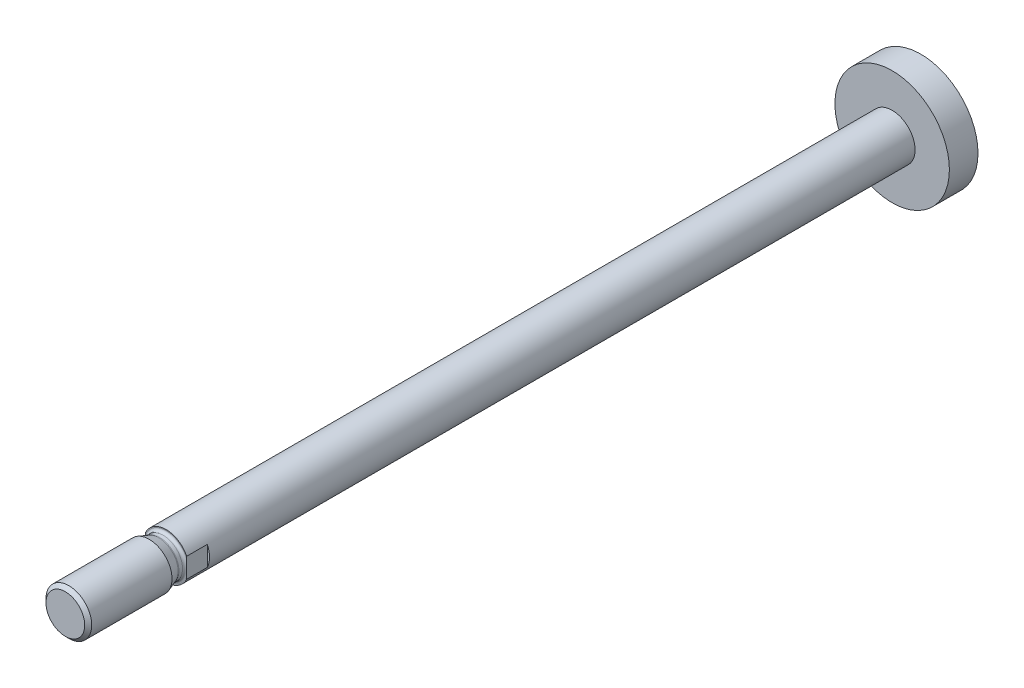
from build123d import *

# Parameters (mm, degrees)
SCHNITT_LINEAR_AUSTRAGEN1_DEPTH = 5.5


with BuildPart() as part:
    # Skizze1 → Rotation1 (revolve)
    with BuildSketch(Plane(origin=(0, 0, 0), x_dir=(0, 0, -1), z_dir=(1, 0, 0))):
        Polygon((-6, 0), (-6, 5), (152.6, 5), (152.6, 12.5), (158.85, 12.5), (158.85, 0), align=None)
    revolve(axis=Axis((0, 0, -158.85), (0, 0, 1)))

    # Skizze2 → Rotation2 (revolve)
    with BuildSketch(Plane(origin=(0, 0, 0), x_dir=(0, 0, -1), z_dir=(1, 0, 0))):
        with BuildLine():
            Line((-28, 0), (-28, 4.233))
            Line((-28, 4.233), (-27.233, 5))
            Line((-27.233, 5), (-9.697981936, 5))
            Line((-9.697981936, 5), (-7.599415898, 4.236184428))
            ThreePointArc((-7.599415898, 4.236184428), (-7.498392718, 4.209115348), (-7.394203812, 4.2))
            Line((-7.394203812, 4.2), (-6.6, 4.2))
            ThreePointArc((-6.6, 4.2), (-6.175735931, 4.375735931), (-6, 4.8))
            Line((-6, 4.8), (-6, 5))
            Line((-6, 5), (-5, 5))
            Line((-5, 5), (-5, 0))
            Line((-5, 0), (-28, 0))
        make_face()
    revolve(axis=Axis((0, 0, 5), (0, 0, 1)))

    # Skizze3 → Schnitt-Linear austragen1 (cut)
    with BuildSketch(Plane.XY.offset(1.5)):
        Polygon((-9, 18), (-9, -9), (-4.5, -9), (-4.5, 9), (4.5, 9), (4.5, -9), (9, -9), (9, 18), align=None)
    extrude(amount=SCHNITT_LINEAR_AUSTRAGEN1_DEPTH, mode=Mode.SUBTRACT)


solid = part.part
